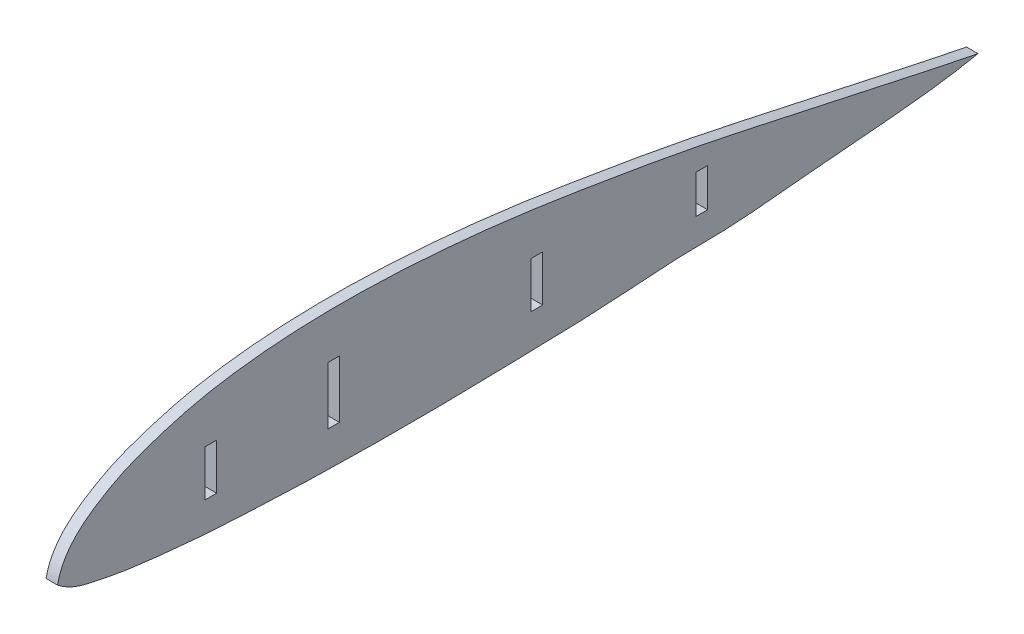
from build123d import *

# Parameters (mm, degrees)
EXTRUDE_1_DEPTH     = 3
SKETCH_2_W          = 3
SKETCH_2_H          = 12
SKETCH_2_H_2        = 15
SKETCH_2_H_3        = 10
CUT_EXTRUDE_1_DEPTH = 3


with BuildPart() as part:
    # Эскиз1 → Бобышка-Вытянуть1 (new body)
    with BuildSketch(Plane(origin=(0, 0, 0), x_dir=(0, 0, -1), z_dir=(1, 0, 0))):
        with BuildLine():
            add(Edge.make_bspline(
                [(-240, 0), (-238.539586148, 6.885975956), (-231.6119689, 12.33782744), (-222.175332595, 17.412091216), (-214.111867769, 20.343482826), (-204.156129061, 23.263904239), (-188.104616678, 25.89332168), (-168.007150597, 26.960143982), (-143.945589986, 26.026388226), (-119.918298994, 23.567750867), (-95.953760008, 19.758812003), (-71.912657951, 15.561977026), (-48.005978392, 10.220578603), (-23.989791717, 5.171383231), (-8.037469261, 1.523600682), (0, 0)],
                knots=[0, 0, 0, 0, 0.075346011, 0.102327605, 0.127890212, 0.177564304, 0.226024831, 0.321726685, 0.417300323, 0.513304723, 0.609920295, 0.706973803, 0.804635001, 0.902346226, 1, 1, 1, 1], degree=3))
            add(Edge.make_bspline(
                [(-240, 0), (-236.52391179, -2.886637123), (-230.220810861, -4.067786061), (-222.028601874, -5.648779907), (-214.009642515, -6.608514015), (-204.019456847, -7.65058139), (-188.010543644, -8.621004369), (-168.008371033, -9.355028053), (-143.997445941, -9.544655848), (-119.996434598, -9.000571646), (-95.984120714, -8.452313319), (-79.444451482, -6.861549256), (-63.412851028, -6.941357818), (-47.421480018, -5.149296578), (-23.951991061, -3.34616289), (-7.916011456, -1.672238148), (0, 0)],
                knots=[0, 0, 0, 0, 0.053475274, 0.07870931, 0.103753204, 0.153672751, 0.203448049, 0.302856431, 0.40219897, 0.501554025, 0.600954522, 0.700430481, 0.707480416, 0.799996455, 0.899715685, 1, 1, 1, 1], degree=3))
        make_face()
    extrude(amount=EXTRUDE_1_DEPTH)

    # Эскиз2 → Вырез-Вытянуть1 (cut)
    with BuildSketch(Plane.ZY):
        with Locations((115, 6)):
            Rectangle(SKETCH_2_W, SKETCH_2_H)
        with Locations((200, 6)):
            Rectangle(SKETCH_2_W, SKETCH_2_H)
        with Locations((168, 7.5)):
            Rectangle(SKETCH_2_W, SKETCH_2_H_2)
        with Locations((72, 5)):
            Rectangle(SKETCH_2_W, SKETCH_2_H_3)
    extrude(amount=-CUT_EXTRUDE_1_DEPTH, mode=Mode.SUBTRACT)


solid = part.part
